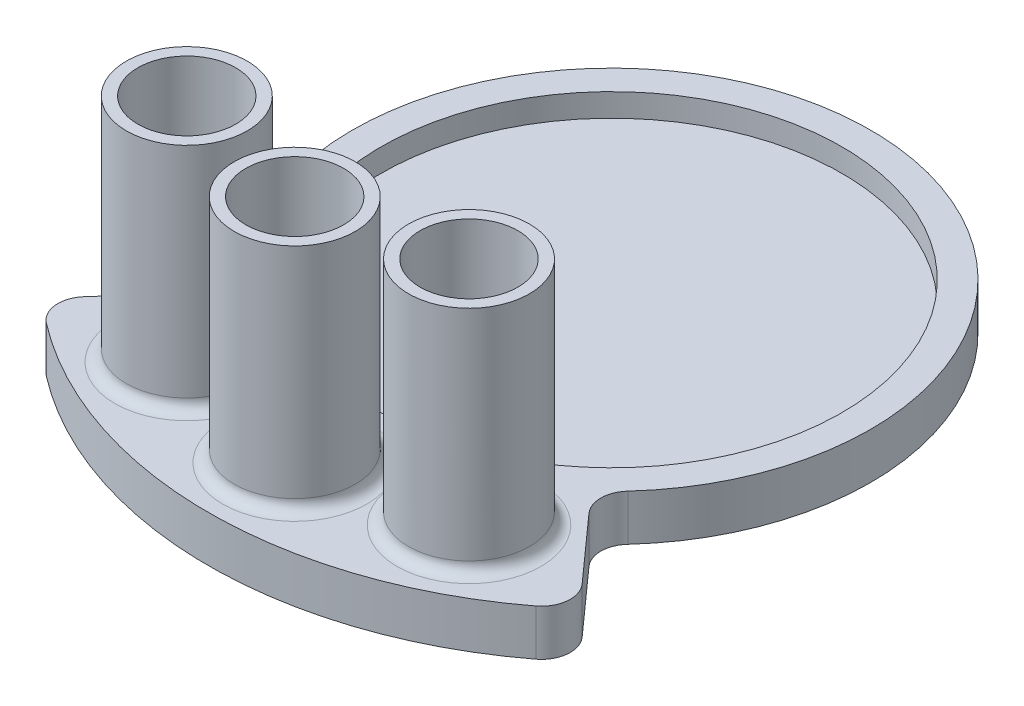
from build123d import *

# Parameters (mm, degrees)
BOSS_EXTRU_1_DEPTH      = 8
ESQUISSE2_R             = 40
ENL_V_MAT_EXTRU_1_DEPTH = 4
ESQUISSE4_R             = 10.5
BOSS_EXTRU_2_DEPTH      = 40
ESQUISSE5_R             = 8.5
ENL_V_MAT_EXTRU_2_DEPTH = 40
CONG_1_R                = 5
CONG_4_R                = 2


with BuildPart() as part:
    # Esquisse1 → Boss.-Extru.1 (new body)
    with BuildSketch(Plane(origin=(0, 0, 0), x_dir=(1, 0, 0), z_dir=(0, 1, 0))):
        with BuildLine():
            Line((-30, -33.541019662), (-46.666666667, -52.174919475))
            ThreePointArc((-46.666666667, -52.174919475), (0, -70), (46.666666667, -52.174919475))
            Line((46.666666667, -52.174919475), (30, -33.541019662))
            ThreePointArc((30, -33.541019662), (0, 45), (-30, -33.541019662))
        make_face()
    extrude(amount=BOSS_EXTRU_1_DEPTH)

    # Esquisse2 → Enlèv. mat.-Extru.1 (cut)
    with BuildSketch(Plane(origin=(0, 8, 0), x_dir=(1, 0, 0), z_dir=(0, 1, 0))):
        with Locations(Location((0, 0, 0), (0, 0, 270))):
            Circle(ESQUISSE2_R)
    extrude(amount=-ENL_V_MAT_EXTRU_1_DEPTH, mode=Mode.SUBTRACT)

    # Esquisse4 → Boss.-Extru.2 (add)
    with BuildSketch(Plane(origin=(0, 8, 0), x_dir=(1, 0, 0), z_dir=(0, 1, 0))):
        with Locations(Location((0, -55, 0), (0, 0, 270))):
            Circle(ESQUISSE4_R)
        with Locations(Location((-24.5, -49.241750578, 0), (0, 0, 270))):
            Circle(ESQUISSE4_R)
        with Locations(Location((24.5, -49.241750578, 0), (0, 0, 90))):
            Circle(ESQUISSE4_R)
    extrude(amount=BOSS_EXTRU_2_DEPTH)

    # Esquisse5 → Enlèv. mat.-Extru.2 (cut)
    with BuildSketch(Plane(origin=(0, 48, 0), x_dir=(1, 0, 0), z_dir=(0, 1, 0))):
        with Locations(Location((0, -55, 0), (0, 0, 270))):
            Circle(ESQUISSE5_R)
        with Locations(Location((-24.5, -49.241750578, 0), (0, 0, 270))):
            Circle(ESQUISSE5_R)
        with Locations(Location((24.5, -49.241750578, 0), (0, 0, 270))):
            Circle(ESQUISSE5_R)
    extrude(amount=-ENL_V_MAT_EXTRU_2_DEPTH, mode=Mode.SUBTRACT)

    # Congé1
    cong_1_edges = [part.edges().sort_by_distance(p)[0] for p in [
        (30, 4, 33.541019662),
        (46.666666667, 4, 52.174919475),
        (-46.666666667, 4, 52.174919475),
        (-30, 4, 33.541019662),
    ]]
    fillet(cong_1_edges, radius=CONG_1_R)

    # Congé4
    cong_4_edges = [part.edges().sort_by_distance(p)[0] for p in [
        (0, 8, 44.5),
        (-24.5, 8, 38.741750578),
        (24.5, 8, 59.741750578),
    ]]
    fillet(cong_4_edges, radius=CONG_4_R)


solid = part.part
